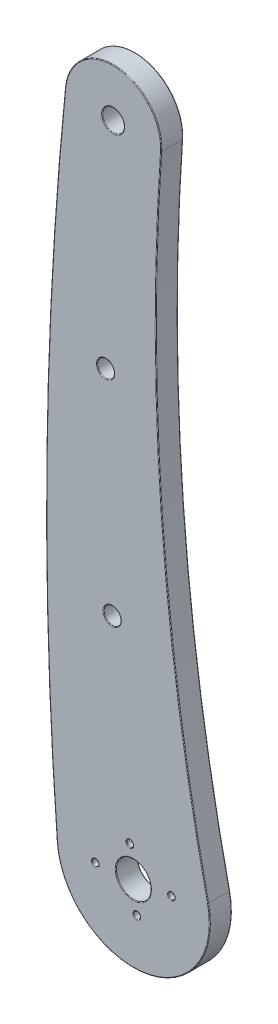
from build123d import *

# Parameters (mm, degrees)
SKETCH1_R              = 2.5
SKETCH1_R_2            = 4
SKETCH1_R_3            = 0.75
BOSS_EXTRUDE4_DEPTH    = 5
M3_5_CLEARANCE_HOLE1_D = 3.9
FILLET1_R              = 0.15


with BuildPart() as part:
    # Sketch1 → Boss-Extrude4 (new body)
    with BuildSketch(Plane.XY):
        with BuildLine():
            ThreePointArc((-13.878259617, 204.743776599), (-13.687602918, 132.675172847), (-3.138134916, 61.382615581))
            ThreePointArc((-3.138134916, 61.382615581), (-17.646769778, 40.270219926), (-37.669332744, 56.249290867))
            ThreePointArc((-37.669332744, 56.249290867), (-40.064330182, 131.474661226), (-35.795618645, 206.616995899))
            ThreePointArc((-35.795618645, 206.616995899), (-23.91498851, 216.467549702), (-13.878259617, 204.743776599))
        make_face()
        with Locations((-24.851714699, 205.507506634)):
            Circle(SKETCH1_R, mode=Mode.SUBTRACT)
        with Locations((-20.22, 57.58)):
            Circle(SKETCH1_R_2, mode=Mode.SUBTRACT)
        with Locations((-21.027197653, 64.281561904)):
            Circle(SKETCH1_R_3, mode=Mode.SUBTRACT)
        with Locations((-28.907209875, 56.533632672)):
            Circle(SKETCH1_R_3, mode=Mode.SUBTRACT)
        with Locations((-11.532790125, 58.626367328)):
            Circle(SKETCH1_R_3, mode=Mode.SUBTRACT)
        with Locations((-19.412802347, 50.878438096)):
            Circle(SKETCH1_R_3, mode=Mode.SUBTRACT)
    extrude(amount=-BOSS_EXTRUDE4_DEPTH)

    # M3.5 Clearance Hole1 (through all)
    with Locations(Plane.XY):
        with Locations((-25.051869168, 107.345982763), (-26.560755288, 155.536723368)):
            Hole(M3_5_CLEARANCE_HOLE1_D / 2)

    # Fillet1
    fillet1_edges = [part.edges().sort_by_distance(p)[0] for p in [
        (-27.351714699, 205.507506634, -5),
        (-27.351714699, 205.507506634, 0),
        (-17.646769778, 40.270219926, -5),
        (-24.22, 57.58, -5),
        (-24.22, 57.58, 0),
        (-13.687602918, 132.675172847, -5),
        (-21.777197653, 64.281561904, -5),
        (-21.777197653, 64.281561904, 0),
        (-29.657209875, 56.533632672, -5),
        (-29.657209875, 56.533632672, 0),
        (-12.282790125, 58.626367328, -5),
        (-12.282790125, 58.626367328, 0),
        (-20.162802347, 50.878438096, -5),
        (-20.162802347, 50.878438096, 0),
        (-24.610755288, 155.536723368, 0),
        (-24.610755288, 155.536723368, -5),
        (-23.101869168, 107.345982763, 0),
        (-23.101869168, 107.345982763, -5),
        (-23.91498851, 216.467549702, -5),
        (-13.687602918, 132.675172847, 0),
        (-17.646769778, 40.270219926, 0),
        (-40.064330182, 131.474661226, 0),
        (-23.91498851, 216.467549702, 0),
        (-40.064330182, 131.474661226, -5),
    ]]
    fillet(fillet1_edges, radius=FILLET1_R)


solid = part.part
